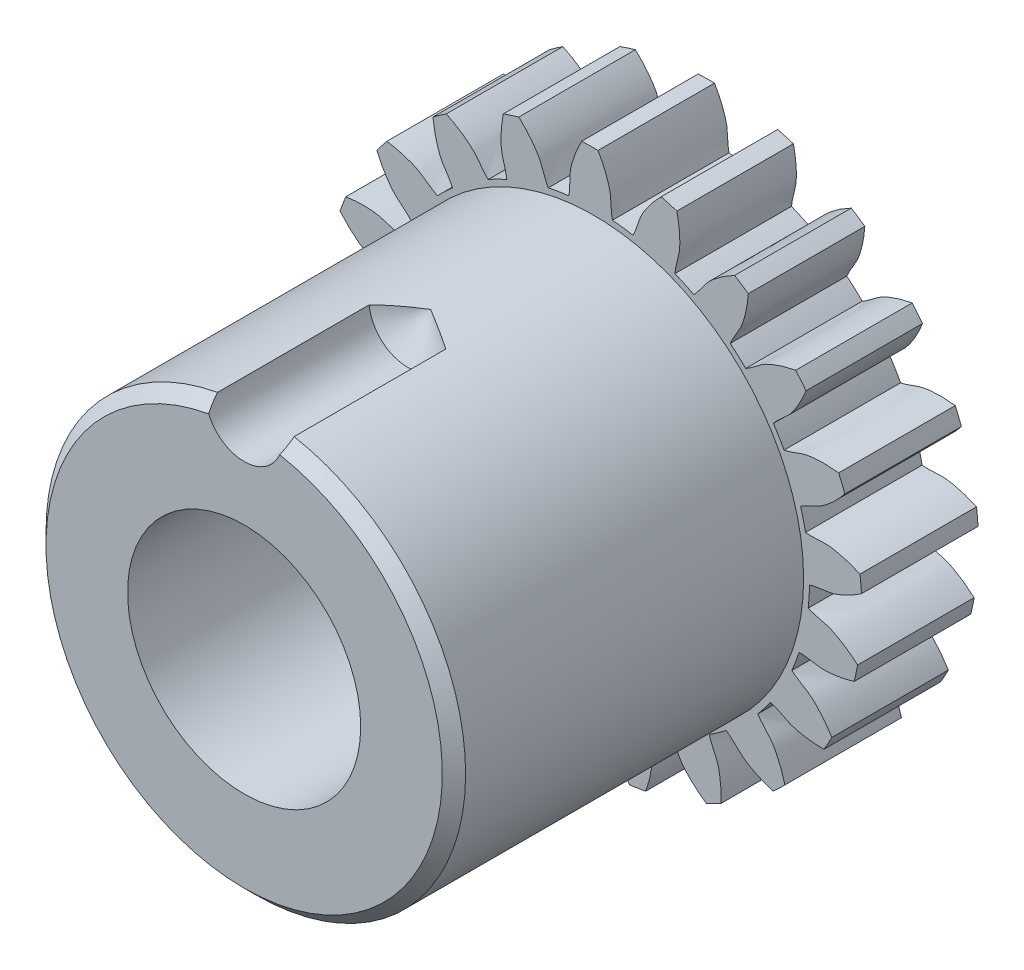
from build123d import *

# Parameters (mm, degrees)
SKETCH_1_R               = 9.25
SKETCH_1_R_2             = 5
EXTRUDE_1_DEPTH          = 5
EXTRUDE_2_DEPTH          = 5
PATTERN_CIRCULAR_1_COUNT = 21
SKETCH_3_R               = 9
SKETCH_3_R_2             = 5
EXTRUDE_3_DEPTH          = 15
HOLE_WIZARD_M4_1_D       = 3.3
HOLE_WIZARD_M4_1_DEPTH   = 7.008579979
HOLE_WIZARD_M4_1_TIP     = 0.991420021
CHAMFER_1_SIZE           = 0.5


with BuildPart() as part:
    # 草图1 → 凸台-拉伸1 (new body)
    with BuildSketch(Plane.XY):
        Circle(SKETCH_1_R)
        Circle(SKETCH_1_R_2, mode=Mode.SUBTRACT)
    extrude(amount=EXTRUDE_1_DEPTH)

    # 草图2 → 凸台-拉伸2 (add)
    with BuildSketch(Plane.XY):
        with BuildLine():
            ThreePointArc((11.417067286, 1.378613282), (11.453761659, 1.030215441), (11.479826982, 0.680861563))
            add(Edge.make_bspline(
                [(11.479826982, 0.680861563), (11.276078075, 0.542430992), (10.962279453, 0.354096031), (10.524043724, 0.161389038), (10.001216724, -0.021689434), (9.554646107, -0.012530954), (9.249370943, -0.107875672)],
                knots=[0, 0, 0, 0, 0.308945746, 0.456629673, 0.599770858, 1, 1, 1, 1], degree=3))
            ThreePointArc((9.249370943, -0.107875672), (9.212808291, 0.82865155), (9.081663133, 1.756671492))
            add(Edge.make_bspline(
                [(11.417067286, 1.378613282), (11.191886073, 1.478463477), (10.849516191, 1.60777897), (10.383926311, 1.719190828), (9.836821083, 1.806033606), (9.399052486, 1.717332707), (9.081663133, 1.756671492)],
                knots=[0, 0, 0, 0, 0.308945746, 0.456629673, 0.599770858, 1, 1, 1, 1], degree=3))
        make_face()
    extrude_2 = extrude(amount=EXTRUDE_2_DEPTH)

    # 阵列(圆周)1: 凸台-拉伸2 ×21 about axis
    pattern_circular_1_axis = Axis((0, 0, 5), (0, 0, -1))
    for i in range(1, PATTERN_CIRCULAR_1_COUNT):
        add(extrude_2.rotate(pattern_circular_1_axis, i * 360 / PATTERN_CIRCULAR_1_COUNT))

    # 草图3 → 凸台-拉伸3 (add)
    with BuildSketch(Plane.XY.offset(5)):
        Circle(SKETCH_3_R)
        Circle(SKETCH_3_R_2, mode=Mode.SUBTRACT)
    extrude(amount=EXTRUDE_3_DEPTH)

    # M4 螺纹孔1
    with Locations(Plane(origin=(0, 9, 20), x_dir=(1, 0, 0), z_dir=(0, 0, 1))):
        with Locations((0, 0)):
            Hole(HOLE_WIZARD_M4_1_D / 2, depth=HOLE_WIZARD_M4_1_DEPTH)
            with Locations((0, 0, -(HOLE_WIZARD_M4_1_DEPTH + HOLE_WIZARD_M4_1_TIP / 2))):  # 118° drill point
                Cone(0, HOLE_WIZARD_M4_1_D / 2, HOLE_WIZARD_M4_1_TIP, mode=Mode.SUBTRACT)

    # 倒角1
    chamfer_1_edges = [part.edges().sort_by_distance(p)[0] for p in [
        (-5.753804057, -6.920530246, 20),
    ]]
    chamfer(chamfer_1_edges, length=CHAMFER_1_SIZE)


solid = part.part
